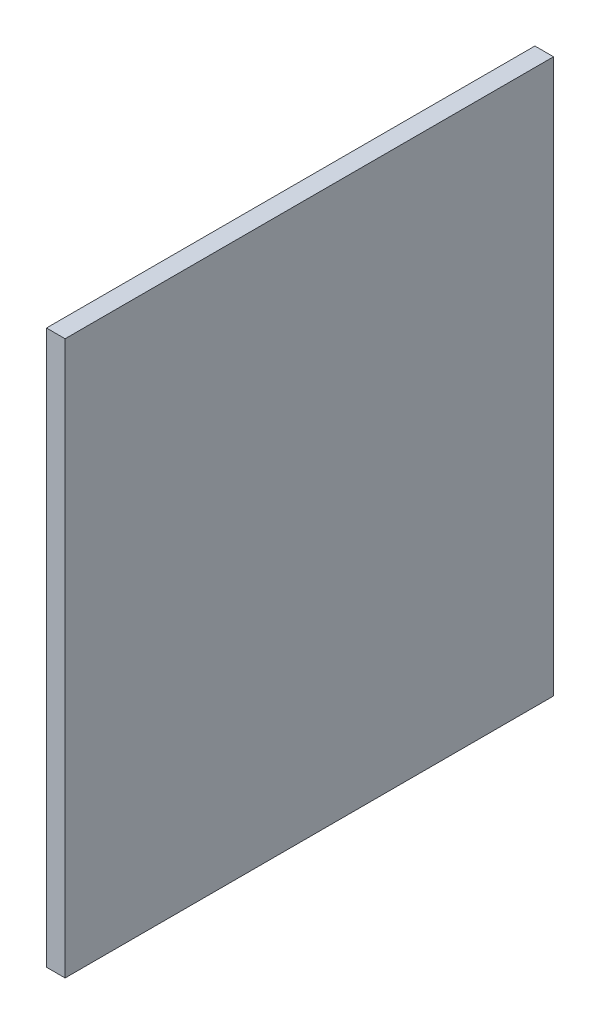
from build123d import *

# Parameters (mm, degrees)
SKETCH1_W           = 472
SKETCH1_H           = 535
BOSS_EXTRUDE1_DEPTH = 18


with BuildPart() as part:
    # Sketch1 → Boss-Extrude1 (new body)
    with BuildSketch(Plane(origin=(0, 0, 0), x_dir=(0, 0, -1), z_dir=(1, 0, 0))):
        with Locations((236, 267.5)):
            Rectangle(SKETCH1_W, SKETCH1_H)
    extrude(amount=BOSS_EXTRUDE1_DEPTH)


solid = part.part
